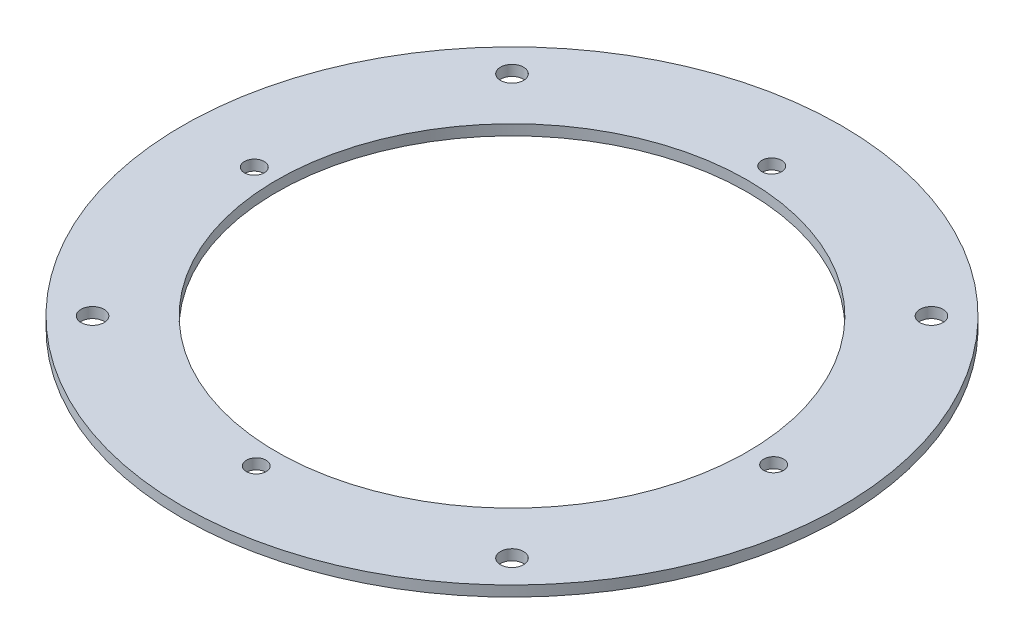
from build123d import *

# Parameters (mm, degrees)
SKETCH1_R           = 50
SKETCH1_R_2         = 35.715
BOSS_EXTRUDE1_DEPTH = 1.59
SKETCH2_R           = 1.5
CUT_EXTRUDE1_DEPTH  = 2
SKETCH3_R           = 1.75
CUT_EXTRUDE2_DEPTH  = 2


with BuildPart() as part:
    # Sketch1 → Boss-Extrude1 (new body)
    with BuildSketch(Plane(origin=(0, 0, 0), x_dir=(1, 0, 0), z_dir=(0, 1, 0))):
        with Locations(Location((0, 0, 0), (0, 0, 90))):
            Circle(SKETCH1_R)
        with Locations(Location((0, 0, 0), (0, 0, 90))):
            Circle(SKETCH1_R_2, mode=Mode.SUBTRACT)
    extrude(amount=BOSS_EXTRUDE1_DEPTH)

    # Sketch2 → Cut-Extrude1 (cut)
    with BuildSketch(Plane(origin=(0, 1.59, 0), x_dir=(1, 0, 0), z_dir=(0, 1, 0))):
        with Locations(Location((0, 39.4, 0), (0, 0, 270))):
            Circle(SKETCH2_R)
        with Locations(Location((39.4, 0.3, 0), (0, 0, 270))):
            Circle(SKETCH2_R)
        with Locations(Location((0.3, -39.1, 0), (0, 0, 270))):
            Circle(SKETCH2_R)
        with Locations(Location((-39.1, 0, 0), (0, 0, 270))):
            Circle(SKETCH2_R)
    extrude(amount=-CUT_EXTRUDE1_DEPTH, mode=Mode.SUBTRACT)

    # Sketch3 → Cut-Extrude2 (cut)
    with BuildSketch(Plane(origin=(0, 1.59, 0), x_dir=(1, 0, 0), z_dir=(0, 1, 0))):
        with Locations(Location((-31.8198, 31.819810307, 0), (0, 0, 270))):
            Circle(SKETCH3_R)
        with Locations(Location((31.819810307, 31.8198, 0), (0, 0, 270))):
            Circle(SKETCH3_R)
        with Locations(Location((31.8198, -31.819810307, 0), (0, 0, 270))):
            Circle(SKETCH3_R)
        with Locations(Location((-31.819810307, -31.8198, 0), (0, 0, 270))):
            Circle(SKETCH3_R)
    extrude(amount=-CUT_EXTRUDE2_DEPTH, mode=Mode.SUBTRACT)


solid = part.part
